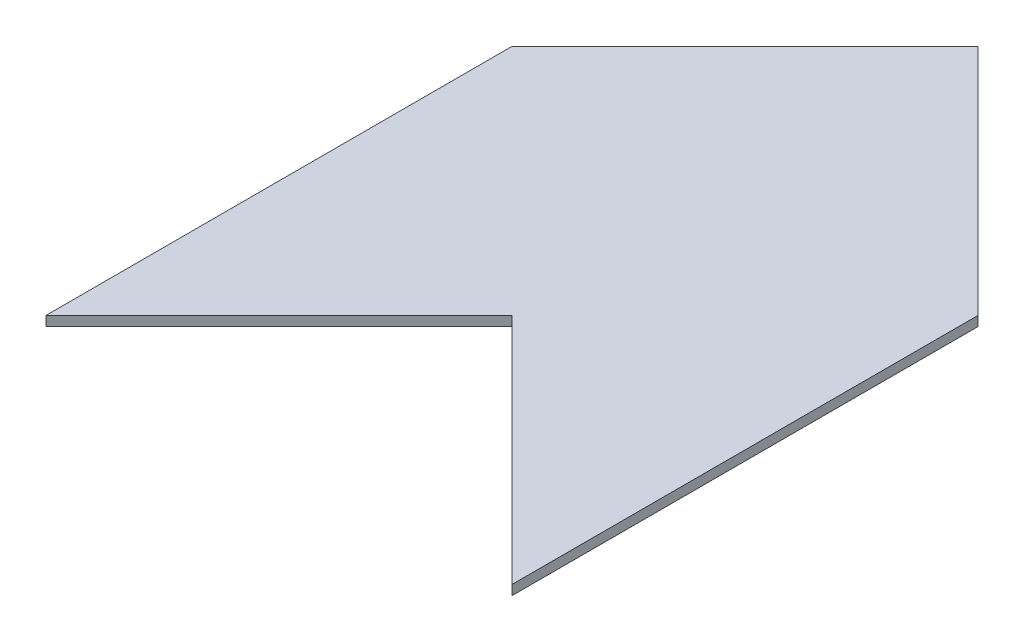
from build123d import *

# Parameters (mm, degrees)
BOSS_EXTRUDE1_DEPTH = 3.175


with BuildPart() as part:
    # Sketch1 → Boss-Extrude1 (new body)
    with BuildSketch(Plane(origin=(0, 0, 0), x_dir=(1, 0, 0), z_dir=(0, 1, 0))):
        Polygon((0, 0), (76.2, -76.2), (76.2, 76.2), (0, 152.4), (-76.2, 76.2), (-76.2, -76.2), align=None)
    extrude(amount=BOSS_EXTRUDE1_DEPTH)


solid = part.part
